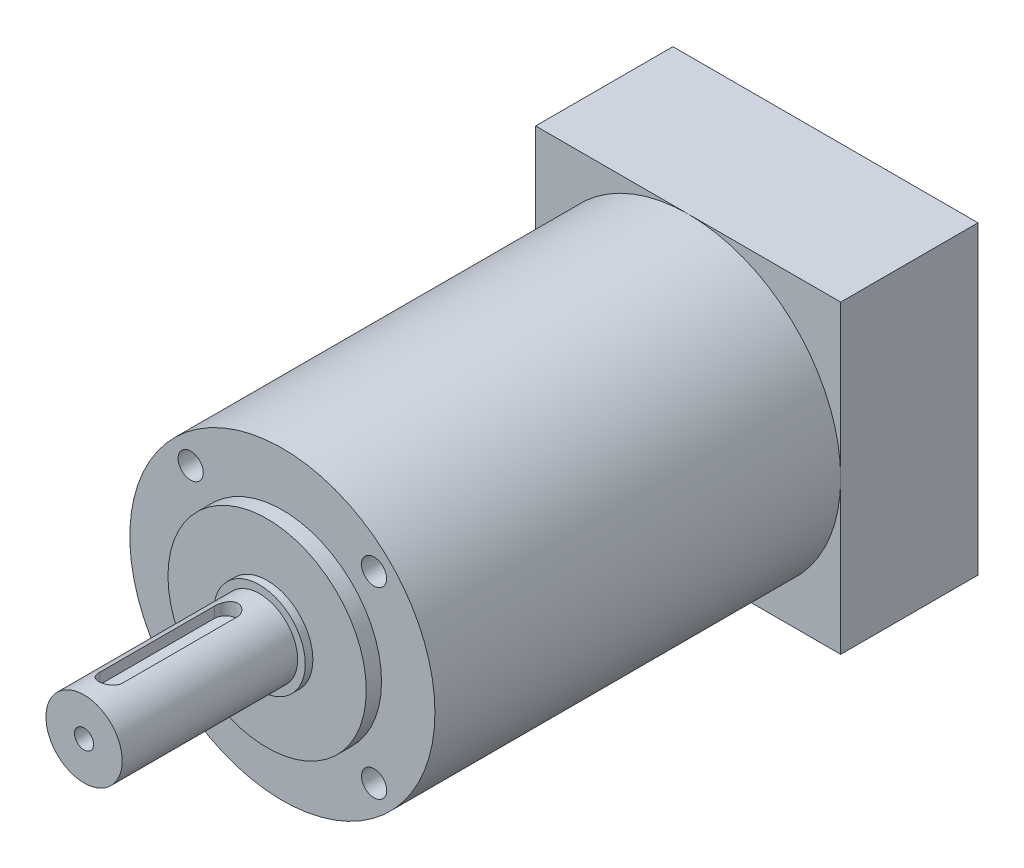
from build123d import *

# Parameters (mm, degrees)
SKETCH_1_W               = 40
SKETCH_1_H               = 40
EXTRUDE_1_DEPTH          = 18
SKETCH_2_R               = 20
EXTRUDE_2_DEPTH          = 53.2
SKETCH_3_R               = 13
EXTRUDE_3_DEPTH          = 2
SKETCH_4_R               = 6
EXTRUDE_4_DEPTH          = 1
SKETCH_5_R               = 5
EXTRUDE_5_DEPTH          = 23
CUT_EXTRUDE_1_DEPTH      = 1.8
HOLE_WIZARD_M31_D        = 2.5
HOLE_WIZARD_M31_DEPTH    = 15
HOLE_WIZARD_M31_TIP      = 0.751075774
PATTERN_CIRCULAR_1_COUNT = 4


with BuildPart() as part:
    # Эскиз1 → Бобышка-Вытянуть1 (new body)
    with BuildSketch(Plane.XY):
        with Locations((20, 20)):
            Rectangle(SKETCH_1_W, SKETCH_1_H)
    extrude(amount=EXTRUDE_1_DEPTH)

    # Эскиз2 → Бобышка-Вытянуть2 (add)
    with BuildSketch(Plane.XY.offset(18)):
        with Locations((20, 20)):
            Circle(SKETCH_2_R)
    extrude(amount=EXTRUDE_2_DEPTH)

    # Эскиз3 → Бобышка-Вытянуть3 (add)
    with BuildSketch(Plane.XY.offset(71.2)):
        with Locations((20, 20)):
            Circle(SKETCH_3_R)
    extrude(amount=EXTRUDE_3_DEPTH)

    # Эскиз4 → Бобышка-Вытянуть4 (add)
    with BuildSketch(Plane.XY.offset(73.2)):
        with Locations((20, 20)):
            Circle(SKETCH_4_R)
    extrude(amount=EXTRUDE_4_DEPTH)

    # Эскиз5 → Бобышка-Вытянуть5 (add)
    with BuildSketch(Plane.XY.offset(74.2)):
        with Locations((20, 20)):
            Circle(SKETCH_5_R)
    extrude(amount=EXTRUDE_5_DEPTH)

    # Эскиз9 → Вырез-Вытянуть1 (cut)
    with BuildSketch(Plane(origin=(0, 25, 0), x_dir=(-1, 0, 0), z_dir=(0, -1, 0))):
        with BuildLine():
            Line((-21.068455004, -93.2), (-21.068455004, -78.2))
            ThreePointArc((-21.068455004, -78.2), (-19.568455004, -76.7), (-18.068455004, -78.2))
            Line((-18.068455004, -78.2), (-18.068455004, -93.2))
            ThreePointArc((-18.068455004, -93.2), (-19.568455004, -94.7), (-21.068455004, -93.2))
        make_face()
    extrude(amount=CUT_EXTRUDE_1_DEPTH, mode=Mode.SUBTRACT)

    # Отверстие обработанное метчиком M31
    with Locations(Plane.XY.offset(97.2)):
        with Locations((20, 20)):
            Hole(HOLE_WIZARD_M31_D / 2, depth=HOLE_WIZARD_M31_DEPTH)
            with Locations((0, 0, -(HOLE_WIZARD_M31_DEPTH + HOLE_WIZARD_M31_TIP / 2))):  # 118° drill point
                Cone(0, HOLE_WIZARD_M31_D / 2, HOLE_WIZARD_M31_TIP, mode=Mode.SUBTRACT)

    # Эскиз14 → Отверстие обработанное метчиком M41 (revolve, cut)
    with BuildSketch(Plane(origin=(7.97918472, 32.02081528, 71.2), x_dir=(0, -1, 0), z_dir=(1, 0, 0))):
        Polygon((0, 0), (0, 7.991420021), (1.65, 7), (1.65, 0), align=None)
    hole_wizard_m41 = revolve(axis=Axis((7.97918472, 32.02081528, 77.55), (0, 0, -1)), mode=Mode.SUBTRACT)

    # Круговой массив1: Отверстие обработанное метчиком M41 ×4 about axis
    pattern_circular_1_axis = Axis((20, 20, 0), (0, 0, 1))
    for i in range(1, PATTERN_CIRCULAR_1_COUNT):
        add(hole_wizard_m41.rotate(pattern_circular_1_axis, i * 360 / PATTERN_CIRCULAR_1_COUNT), mode=Mode.SUBTRACT)


solid = part.part
